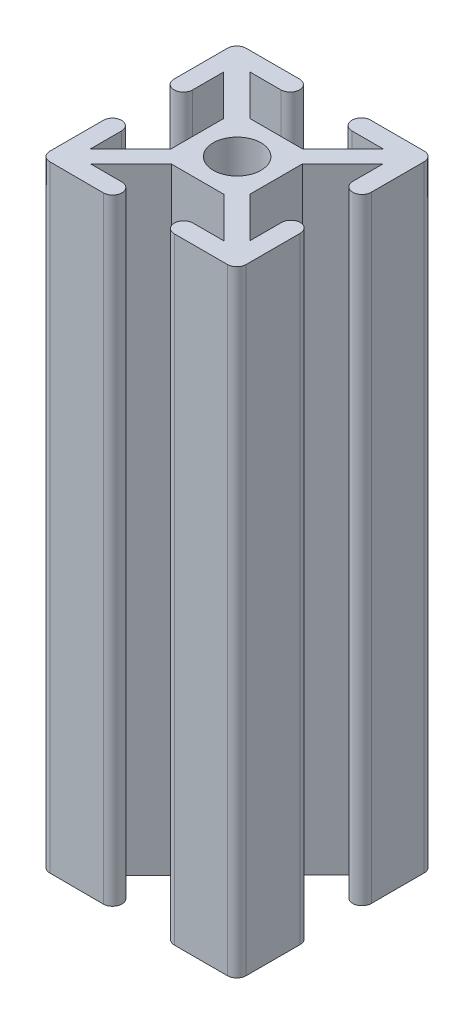
from build123d import *

# Parameters (mm, degrees)
SKETCH1_R           = 3.645
BOSS_EXTRUDE1_DEPTH = 93.98
SKETCH2_R           = 4
CUT_EXTRUDE1_DEPTH  = 93.98


with BuildPart() as part:
    # Sketch1 → Boss-Extrude1 (new body)
    with BuildSketch(Plane(origin=(0, 0, 0), x_dir=(1, 0, 0), z_dir=(0, 1, 0))):
        with BuildLine():
            Line((11.476895811, 1.535297401), (16.201895811, 1.535297401))
            Line((16.201895811, 1.535297401), (10.051895811, 7.685297401))
            Line((10.051895811, 7.685297401), (2.051895811, 7.685297401))
            Line((2.051895811, 7.685297401), (-4.098104189, 1.535297401))
            Line((-4.098104189, 1.535297401), (0.626895811, 1.535297401))
            ThreePointArc((0.626895811, 1.535297401), (2.051895811, 0.110297401), (0.626895811, -1.314702599))
            Line((0.626895811, -1.314702599), (-7.549539962, -1.288266826))
            ThreePointArc((-7.549539962, -1.288266826), (-8.538474211, -0.878636848), (-8.948104189, 0.110297401))
            Line((-8.948104189, 0.110297401), (-8.948104189, 8.260297401))
            ThreePointArc((-8.948104189, 8.260297401), (-7.549539962, 9.658861629), (-6.150975734, 8.260297401))
            Line((-6.150975734, 8.260297401), (-6.150975734, 3.535297401))
            Line((-6.150975734, 3.535297401), (-0.000975734, 9.685297401))
            Line((-0.000975734, 9.685297401), (-0.000975734, 17.685297401))
            Line((-0.000975734, 17.685297401), (-6.150975734, 23.835297401))
            Line((-6.150975734, 23.835297401), (-6.150975734, 19.110297401))
            ThreePointArc((-6.150975734, 19.110297401), (-7.575975734, 17.685297401), (-9.000975734, 19.110297401))
            Line((-9.000975734, 19.110297401), (-9.000975734, 27.260250811))
            ThreePointArc((-9.000975734, 27.260250811), (-8.583602897, 28.267877974), (-7.575975734, 28.685250811))
            Line((-7.575975734, 28.685250811), (0.574024266, 28.685250811))
            ThreePointArc((0.574024266, 28.685250811), (1.999024266, 27.260250811), (0.574024266, 25.835250811))
            Line((0.574024266, 25.835250811), (-4.150975734, 25.835250811))
            Line((-4.150975734, 25.835250811), (1.999024266, 19.685250811))
            Line((1.999024266, 19.685250811), (9.999024266, 19.685250811))
            Line((9.999024266, 19.685250811), (16.149024266, 25.835250811))
            Line((16.149024266, 25.835250811), (11.424024266, 25.835250811))
            ThreePointArc((11.424024266, 25.835250811), (9.999024266, 27.260250811), (11.424024266, 28.685250811))
            Line((11.424024266, 28.685250811), (19.574024266, 28.685250811))
            ThreePointArc((19.574024266, 28.685250811), (20.581651429, 28.267877974), (20.999024266, 27.260250811))
            Line((20.999024266, 27.260250811), (20.999024266, 19.213994497))
            ThreePointArc((20.999024266, 19.213994497), (19.574024266, 17.788994497), (18.149024266, 19.213994497))
            Line((18.149024266, 19.213994497), (18.149024266, 23.835250811))
            Line((18.149024266, 23.835250811), (11.999024266, 17.685250811))
            Line((11.999024266, 17.685250811), (11.999024266, 9.685250811))
            Line((11.999024266, 9.685250811), (18.149024266, 3.535250811))
            Line((18.149024266, 3.535250811), (18.149024266, 8.363994497))
            ThreePointArc((18.149024266, 8.363994497), (19.574024266, 9.788994497), (20.999024266, 8.363994497))
            Line((20.999024266, 8.363994497), (20.999024266, 0.110297401))
            ThreePointArc((20.999024266, 0.110297401), (20.581651429, -0.897329762), (19.574024266, -1.314702599))
            Line((19.574024266, -1.314702599), (11.476895811, -1.314702599))
            ThreePointArc((11.476895811, -1.314702599), (10.051895811, 0.110297401), (11.476895811, 1.535297401))
        make_face()
        with Locations(Location((6.051895811, 13.685297401, 0), (0, 0, 270))):
            Circle(SKETCH1_R, mode=Mode.SUBTRACT)
    extrude(amount=BOSS_EXTRUDE1_DEPTH)

    # Sketch2 → Cut-Extrude1 (cut)
    with BuildSketch(Plane(origin=(11.999024266, 0, 0), x_dir=(0, 0, -1), z_dir=(1, 0, 0))):
        with Locations((13.685250811, 75.14)):
            Circle(SKETCH2_R)
        with Locations((13.685250811, 18.84)):
            Circle(SKETCH2_R)
    extrude(amount=-CUT_EXTRUDE1_DEPTH, mode=Mode.SUBTRACT)


solid = part.part
